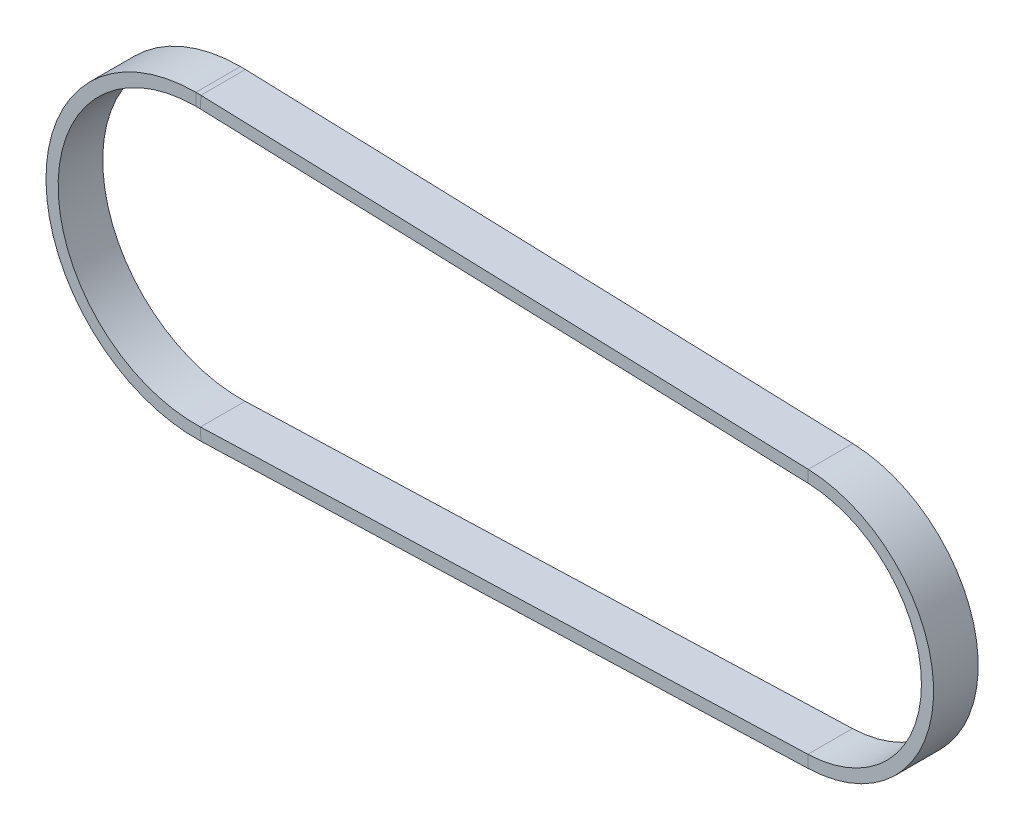
from build123d import *

# Parameters (mm, degrees)
SKETCH2_W = 11
SKETCH2_H = 3


with BuildPart() as part:
    # Sweep1: sweep along a path in Sketch1
    with BuildLine(Plane.XY) as sweep1_path:
        Line((1.233333333, 36.979438731), (151.066666667, 31.982217281))
        ThreePointArc((151.066666667, 31.982217281), (182, 0), (151.066666667, -31.982217281))
        Line((151.066666667, -31.982217281), (1.233333333, -36.979438731))
        ThreePointArc((1.233333333, -36.979438731), (-37, 0), (1.233333333, 36.979438731))
    # Sketch2 → Sweep1 (sweep)
    with BuildSketch(Plane(origin=(0, 0, 0), x_dir=(0, 0, -1), z_dir=(1, 0, 0))):
        with Locations((0, 35.479438731)):
            Rectangle(SKETCH2_W, SKETCH2_H)
    sweep(path=sweep1_path.line)


solid = part.part
